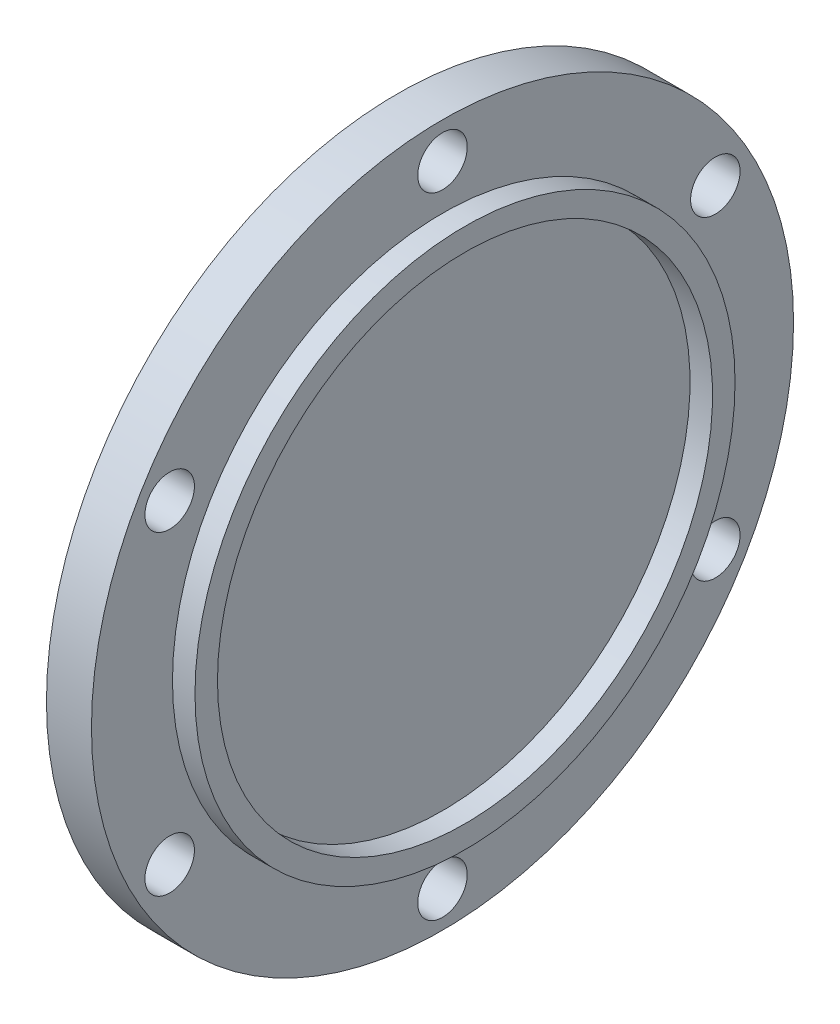
from build123d import *

# Parameters (mm, degrees)
SKETCH2_R          = 5.5
CUT_EXTRUDE1_DEPTH = 20
CIRPATTERN1_COUNT  = 6


with BuildPart() as part:
    # Sketch1 → Revolve1 (revolve)
    with BuildSketch(Plane.XY, mode=Mode.PRIVATE) as revolve1_sk:
        Polygon((10, 78), (0, 78), (0, 0), (10, 0), (10, 55), (15, 55), (15, 60), (10, 60), align=None)
    revolve(revolve1_sk.sketch.rotate(Axis((0, 0, 0), (1, 0, 0)), 90), axis=Axis((0, 0, 0), (1, 0, 0)))

    # Sketch2 → Cut-Extrude1 (cut)
    with BuildSketch(Plane(origin=(10, 0, 0), x_dir=(0, 0, -1), z_dir=(1, 0, 0))):
        with Locations((60.621778265, 35)):
            Circle(SKETCH2_R)
    cut_extrude1 = extrude(amount=-CUT_EXTRUDE1_DEPTH, mode=Mode.SUBTRACT)

    # CirPattern1: Cut-Extrude1 ×6 about axis
    cirpattern1_axis = Axis((0, 0, 0), (1, 0, 0))
    for i in range(1, CIRPATTERN1_COUNT):
        add(cut_extrude1.rotate(cirpattern1_axis, i * 360 / CIRPATTERN1_COUNT), mode=Mode.SUBTRACT)


solid = part.part
